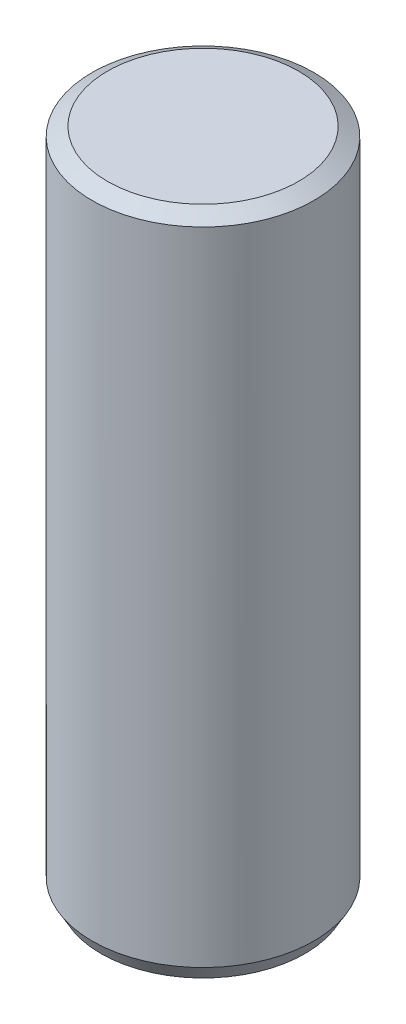
from build123d import *
from OCP.BRepFilletAPI import BRepFilletAPI_MakeChamfer

# Parameters (mm, degrees)
SKETCH1_R           = 3.175
BOSS_EXTRUDE1_DEPTH = 19.05
CHAMFER1_SIZE       = 0.254
CHAMFER1_SIZE2      = 0.439940905


with BuildPart() as part:
    # Sketch1 → Boss-Extrude1 (new body)
    with BuildSketch(Plane(origin=(0, 0, 0), x_dir=(1, 0, 0), z_dir=(0, 1, 0))):
        with Locations(Location((0, 0, 0), (0, 0, 90))):
            Circle(SKETCH1_R)
    extrude(amount=BOSS_EXTRUDE1_DEPTH)

    # Chamfer1: one chamfer whose edges measure the first distance from different faces: ONE call of the kernel's chamfer builder (chamfer() names one face for all edges)
    chamfer1_edges_1 = [part.edges().sort_by_distance(p)[0] for p in [
        (0, 0, 3.175),
    ]]
    chamfer1_side_1 = [part.faces().sort_by_distance(p)[0] for p in [
        (0, 0, 0),
    ]]
    chamfer1_edges_2 = [part.edges().sort_by_distance(p)[0] for p in [
        (0, 19.05, 3.175),
    ]]
    chamfer1_side_2 = [part.faces().sort_by_distance(p)[0] for p in [
        (0, 9.525, 3.175),
    ]]
    chamfer1 = BRepFilletAPI_MakeChamfer(part.part.solid().wrapped)
    for e in chamfer1_edges_1:
        chamfer1.Add(CHAMFER1_SIZE, CHAMFER1_SIZE2, e.wrapped, chamfer1_side_1[0].wrapped)  # the first distance lies on this face
    for e in chamfer1_edges_2:
        chamfer1.Add(CHAMFER1_SIZE, CHAMFER1_SIZE2, e.wrapped, chamfer1_side_2[0].wrapped)  # the first distance lies on this face
    add(Compound.cast(chamfer1.Shape()), mode=Mode.REPLACE)


solid = part.part
